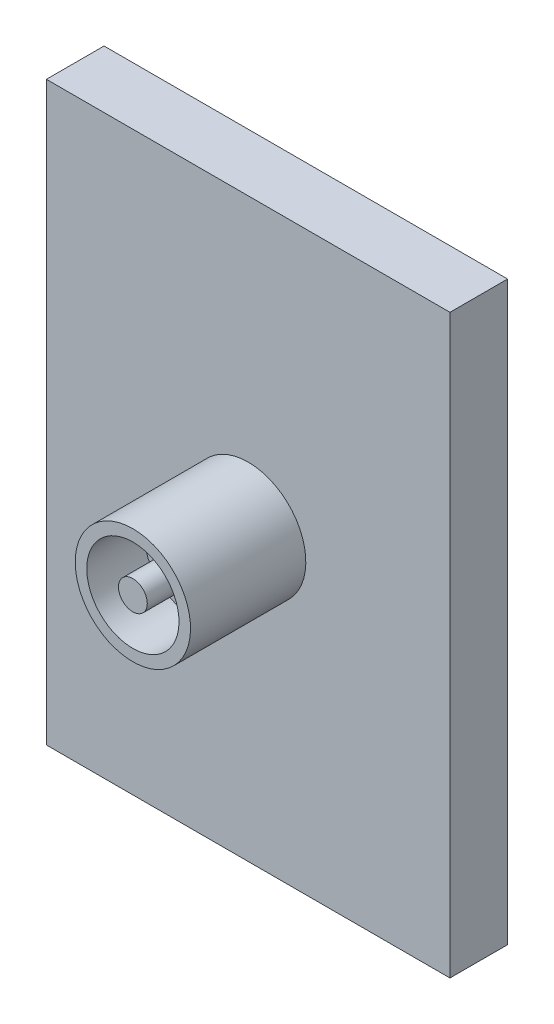
from build123d import *

# Parameters (mm, degrees)
SKETCH1_W           = 70
SKETCH1_H           = 100
BOSS_EXTRUDE1_DEPTH = 5
SKETCH3_R           = 2.5
BOSS_EXTRUDE2_DEPTH = 20


with BuildPart() as part:
    # Sketch1 → Boss-Extrude1 (new, symmetric)
    with BuildSketch(Plane.XY):
        Rectangle(SKETCH1_W, SKETCH1_H)
    extrude(amount=BOSS_EXTRUDE1_DEPTH, both=True)

    # Sketch3 → Boss-Extrude2 (add)
    with BuildSketch(Plane.XY.offset(5)):
        with Locations(Location((0, 0, 0), (0, 0, 180))):
            Circle(SKETCH3_R)
    extrude(amount=BOSS_EXTRUDE2_DEPTH)

    # Sketch5 → Revolve1 (revolve)
    with BuildSketch(Plane(origin=(0, 0, 0), x_dir=(0, 0, -1), z_dir=(1, 0, 0))):
        Polygon((-5, 6), (-15, 6), (-15, 8), (-25, 8), (-25, 10), (-5, 10), align=None)
    revolve(axis=Axis((0, 0, 0), (0, 0, 1)))


solid = part.part
